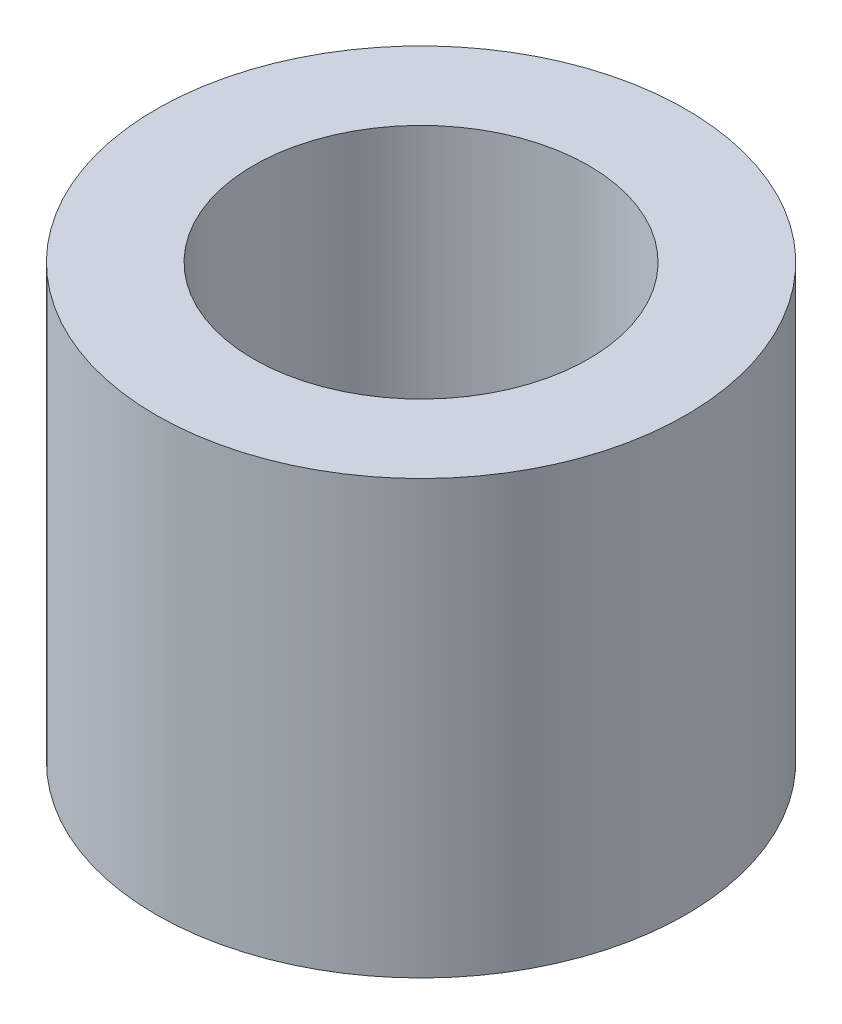
from build123d import *

# Parameters (mm, degrees)
SKETCH2_R           = 2.45
BOSS_EXTRUDE1_DEPTH = 4
SKETCH4_R           = 1.55
CUT_EXTRUDE1_DEPTH  = 3


with BuildPart() as part:
    # Sketch2 → Boss-Extrude1 (new body)
    with BuildSketch(Plane(origin=(0, 0, 0), x_dir=(1, 0, 0), z_dir=(0, 1, 0))):
        with Locations(Location((0, 0, 0), (0, 0, 270))):
            Circle(SKETCH2_R)
    extrude(amount=BOSS_EXTRUDE1_DEPTH)

    # Sketch4 → Cut-Extrude1 (cut)
    with BuildSketch(Plane(origin=(0, 4, 0), x_dir=(1, 0, 0), z_dir=(0, 1, 0))):
        with Locations(Location((0, 0, 0), (0, 0, 270))):
            Circle(SKETCH4_R)
    extrude(amount=-CUT_EXTRUDE1_DEPTH, mode=Mode.SUBTRACT)


solid = part.part
